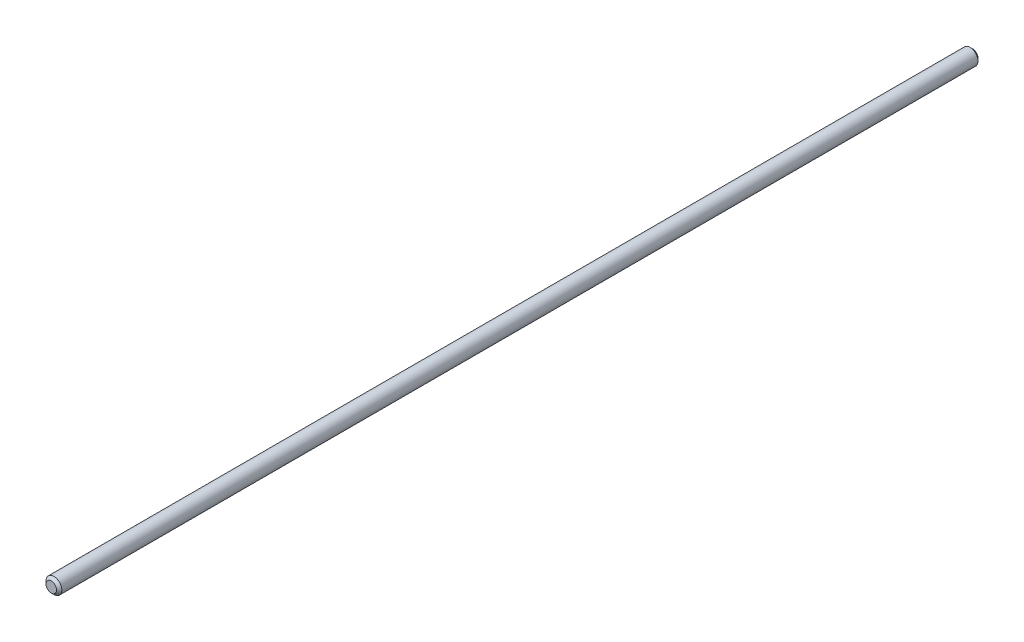
from build123d import *

# Parameters (mm, degrees)
SKETCH_1_R      = 1.5
EXTRUDE_1_DEPTH = 175
CHAMFER_1_SIZE  = 0.5


with BuildPart() as part:
    # Эскиз1 → Бобышка-Вытянуть1 (new body)
    with BuildSketch(Plane.XY):
        Circle(SKETCH_1_R)
    extrude(amount=EXTRUDE_1_DEPTH)

    # Фаска1
    chamfer_1_edges = [part.edges().sort_by_distance(p)[0] for p in [
        (-1.5, 0, 0),
        (-1.5, 0, 175),
    ]]
    chamfer(chamfer_1_edges, length=CHAMFER_1_SIZE)


solid = part.part
